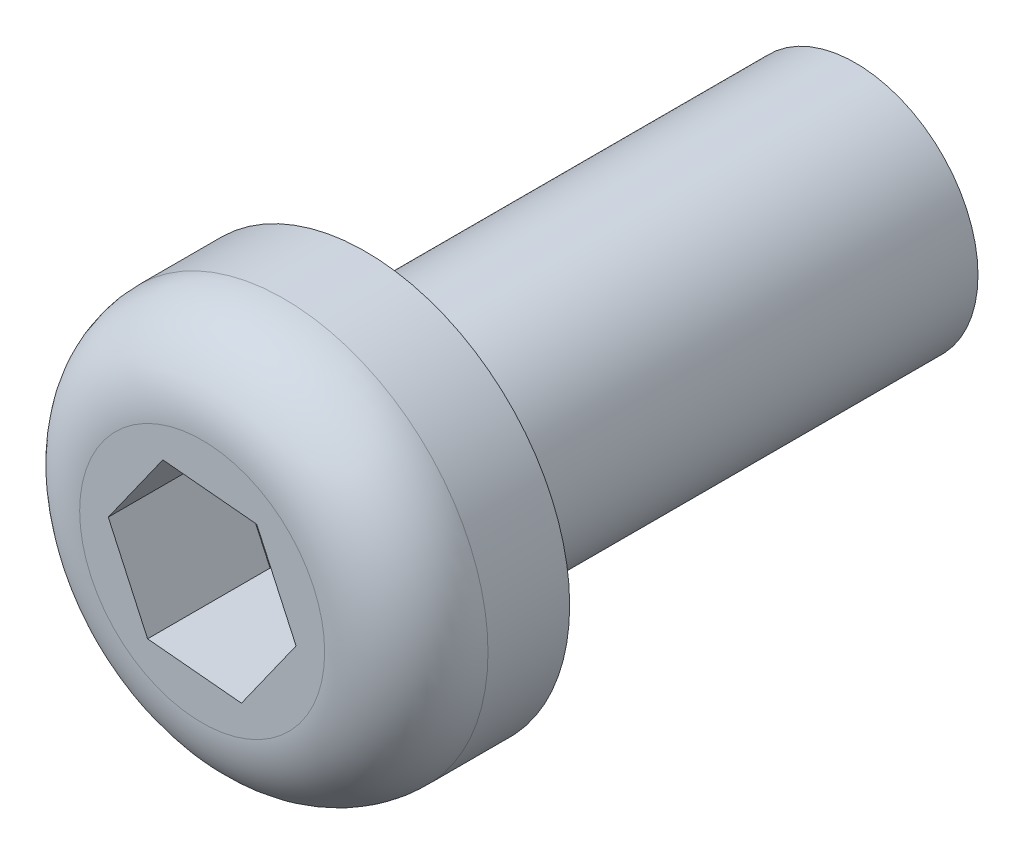
from build123d import *

# Parameters (mm, degrees)
SKETCH_1_R          = 1.5
EXTRUDE_1_DEPTH     = 6
SKETCH_2_R          = 2.5
EXTRUDE_2_DEPTH     = 2
CUT_EXTRUDE_1_DEPTH = 1.5
FILLET_2_R          = 1


with BuildPart() as part:
    # 草图1 → 凸台-拉伸1 (new body)
    with BuildSketch(Plane.XY):
        Circle(SKETCH_1_R)
    extrude(amount=EXTRUDE_1_DEPTH)

    # 草图2 → 凸台-拉伸2 (add)
    with BuildSketch(Plane.XY.offset(6)):
        Circle(SKETCH_2_R)
    extrude(amount=EXTRUDE_2_DEPTH)

    # 草图3 → 切除-拉伸1 (cut)
    with BuildSketch(Plane.XY.offset(8)):
        Polygon((1.149641735, -0.107968584), (0.668324404, 0.941634655), (-0.481317331, 1.04960324), (-1.149641735, 0.107968584), (-0.668324404, -0.941634655), (0.481317331, -1.04960324), align=None)
    extrude(amount=-CUT_EXTRUDE_1_DEPTH, mode=Mode.SUBTRACT)

    # 圆角2
    fillet_2_edges = [part.edges().sort_by_distance(p)[0] for p in [
        (-2.5, 0, 8),
    ]]
    fillet(fillet_2_edges, radius=FILLET_2_R)


solid = part.part
